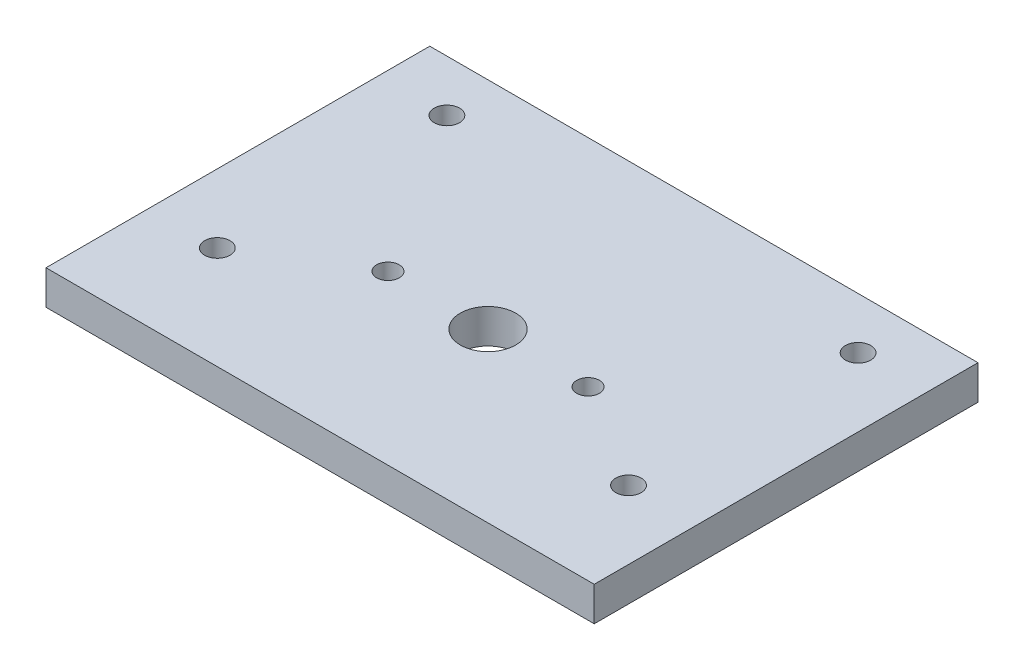
from build123d import *

# Parameters (mm, degrees)
SKETCH1_W                       = 101.6
SKETCH1_H                       = 71.12
BASE_DEPTH                      = 6.35
WOODSCREW_CLEARANCE_HOLES_D     = 4.699
WOODSCREW_CLEARANCE_HOLES_DEPTH = 6.35
WOODSCREW_CLEARANCE_HOLES_TIP   = 1.411722024
SHAFT_CLEARANCE_HOLE_D          = 10.2616
SHAFT_CLEARANCE_HOLE_DEPTH      = 6.35
SHAFT_CLEARANCE_HOLE_TIP        = 3.082895664
M5X0_8_TAPPED_HOLE1_D           = 4.2


with BuildPart() as part:
    # Sketch1 → base (new body)
    with BuildSketch(Plane(origin=(0, 0, 0), x_dir=(1, 0, 0), z_dir=(0, 1, 0))):
        with Locations((50.8, 35.56)):
            Rectangle(SKETCH1_W, SKETCH1_H)
    extrude(amount=BASE_DEPTH)

    # woodscrew clearance holes
    with Locations(Plane(origin=(0, 6.35, 0), x_dir=(1, 0, 0), z_dir=(0, 1, 0))):
        with Locations((12.7, 61.595), (88.9, 61.595), (88.9, 19.05), (12.7, 19.05)):
            Hole(WOODSCREW_CLEARANCE_HOLES_D / 2, depth=WOODSCREW_CLEARANCE_HOLES_DEPTH)
            with Locations((0, 0, -(WOODSCREW_CLEARANCE_HOLES_DEPTH + WOODSCREW_CLEARANCE_HOLES_TIP / 2))):  # 118° drill point
                Cone(0, WOODSCREW_CLEARANCE_HOLES_D / 2, WOODSCREW_CLEARANCE_HOLES_TIP, mode=Mode.SUBTRACT)

    # shaft clearance hole
    with Locations(Plane(origin=(0, 6.35, 0), x_dir=(1, 0, 0), z_dir=(0, 1, 0))):
        with Locations((50.8, 31.115)):
            Hole(SHAFT_CLEARANCE_HOLE_D / 2, depth=SHAFT_CLEARANCE_HOLE_DEPTH)
            with Locations((0, 0, -(SHAFT_CLEARANCE_HOLE_DEPTH + SHAFT_CLEARANCE_HOLE_TIP / 2))):  # 118° drill point
                Cone(0, SHAFT_CLEARANCE_HOLE_D / 2, SHAFT_CLEARANCE_HOLE_TIP, mode=Mode.SUBTRACT)

    # M5x0.8 Tapped Hole1 (through all)
    with Locations(Plane(origin=(0, 6.35, 0), x_dir=(1, 0, 0), z_dir=(0, 1, 0))):
        with Locations((32.258, 31.115), (69.342, 31.115)):
            Hole(M5X0_8_TAPPED_HOLE1_D / 2)


solid = part.part
